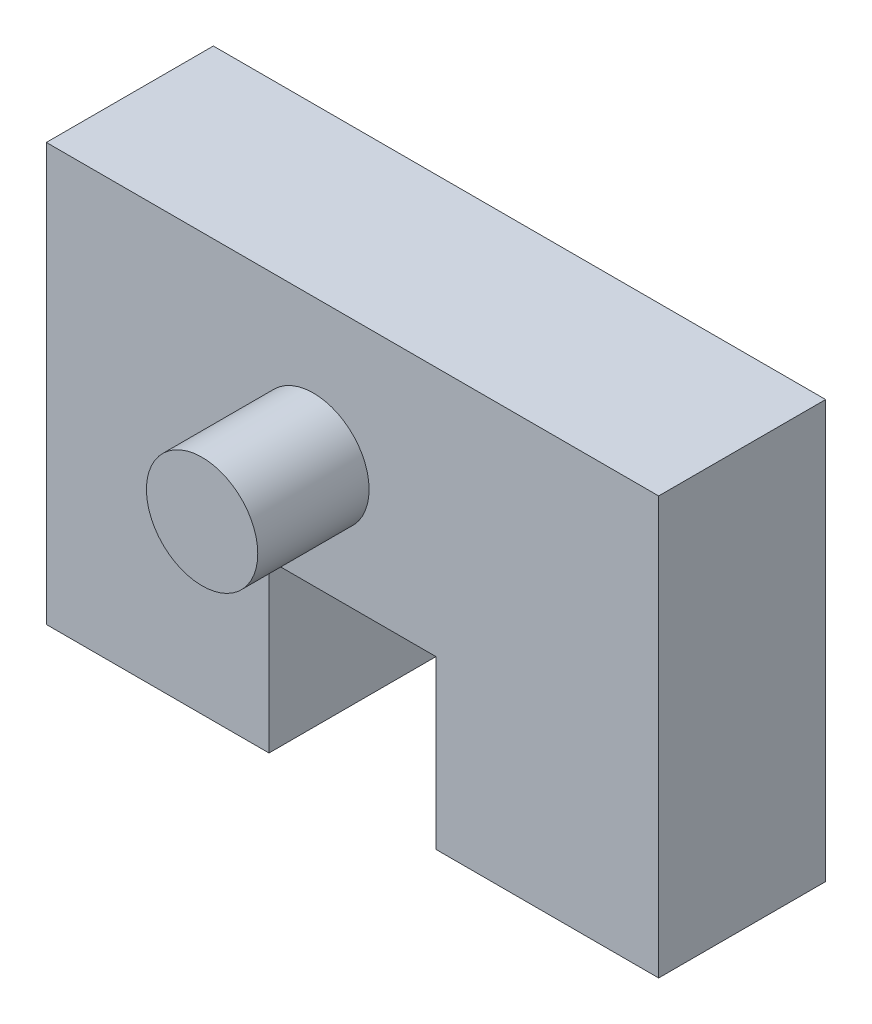
from build123d import *

# Parameters (mm, degrees)
ESQUISSE1_W        = 8
ESQUISSE1_H        = 6
BOSS_EXTRU_1_DEPTH = 6
ESQUISSE2_R        = 2
BOSS_EXTRU_2_DEPTH = 4


with BuildPart() as part:
    # Esquisse1 → Boss.-Extru.1 (new body)
    with BuildSketch(Plane.XY):
        Polygon((-8, 6), (0, 6), (0, 15), (-22, 15), (-22, 6), (-14, 6), align=None)
        with Locations((-4, 3)):
            Rectangle(ESQUISSE1_W, ESQUISSE1_H)
        with Locations((-18, 3)):
            Rectangle(ESQUISSE1_W, ESQUISSE1_H)
    extrude(amount=BOSS_EXTRU_1_DEPTH)

    # Esquisse2 → Boss.-Extru.2 (add)
    with BuildSketch(Plane.XY.offset(6)):
        with Locations((-12.403841621, 10)):
            Circle(ESQUISSE2_R)
    extrude(amount=BOSS_EXTRU_2_DEPTH)


solid = part.part
